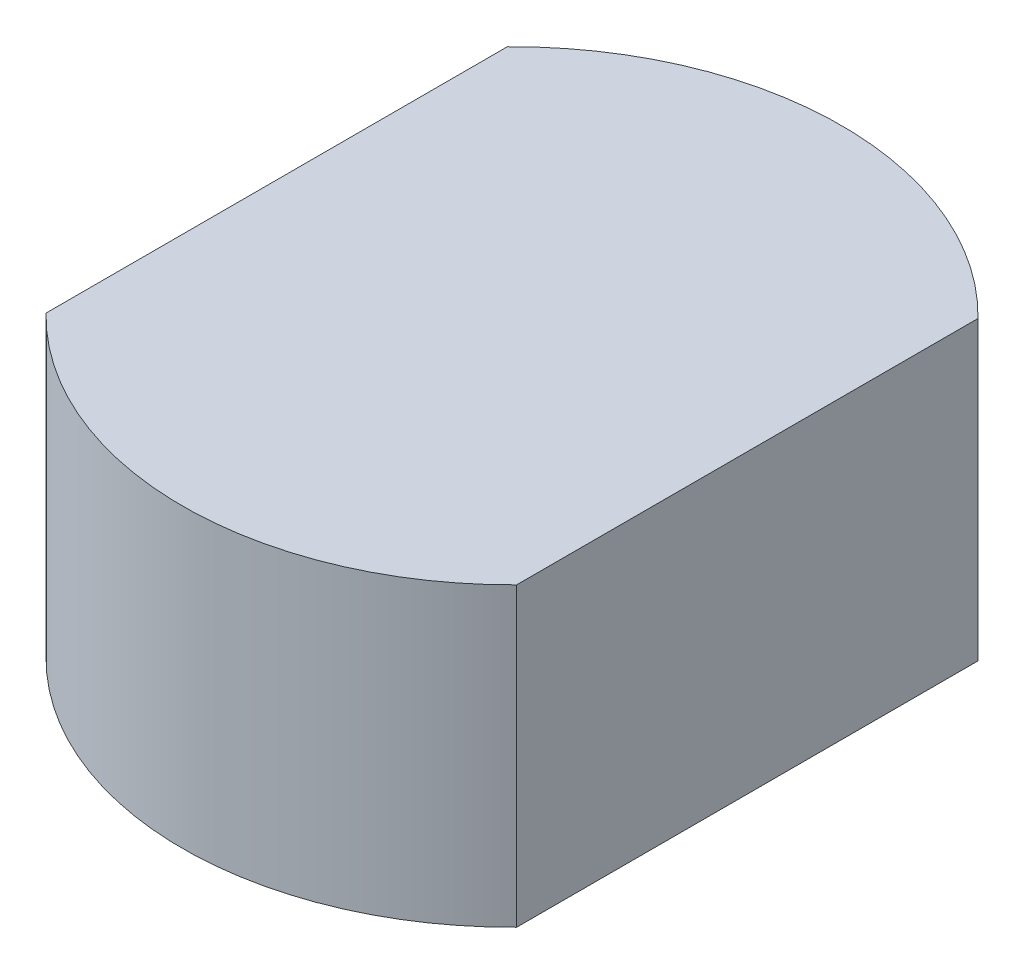
from build123d import *

# Parameters (mm, degrees)
AUFSATZ_LINEAR_AUSTRAGEN1_DEPTH = 9


with BuildPart() as part:
    # Skizze1 → Aufsatz-Linear austragen1 (new body)
    with BuildSketch(Plane(origin=(0, 0, 0), x_dir=(1, 0, 0), z_dir=(0, 1, 0))):
        with BuildLine():
            Line((7.141428429, 7), (7.141428429, -7))
            ThreePointArc((7.141428429, -7), (0, -10), (-7.141428429, -7))
            Line((-7.141428429, -7), (-7.141428429, 7))
            ThreePointArc((-7.141428429, 7), (0, 10), (7.141428429, 7))
        make_face()
    extrude(amount=AUFSATZ_LINEAR_AUSTRAGEN1_DEPTH)


solid = part.part
